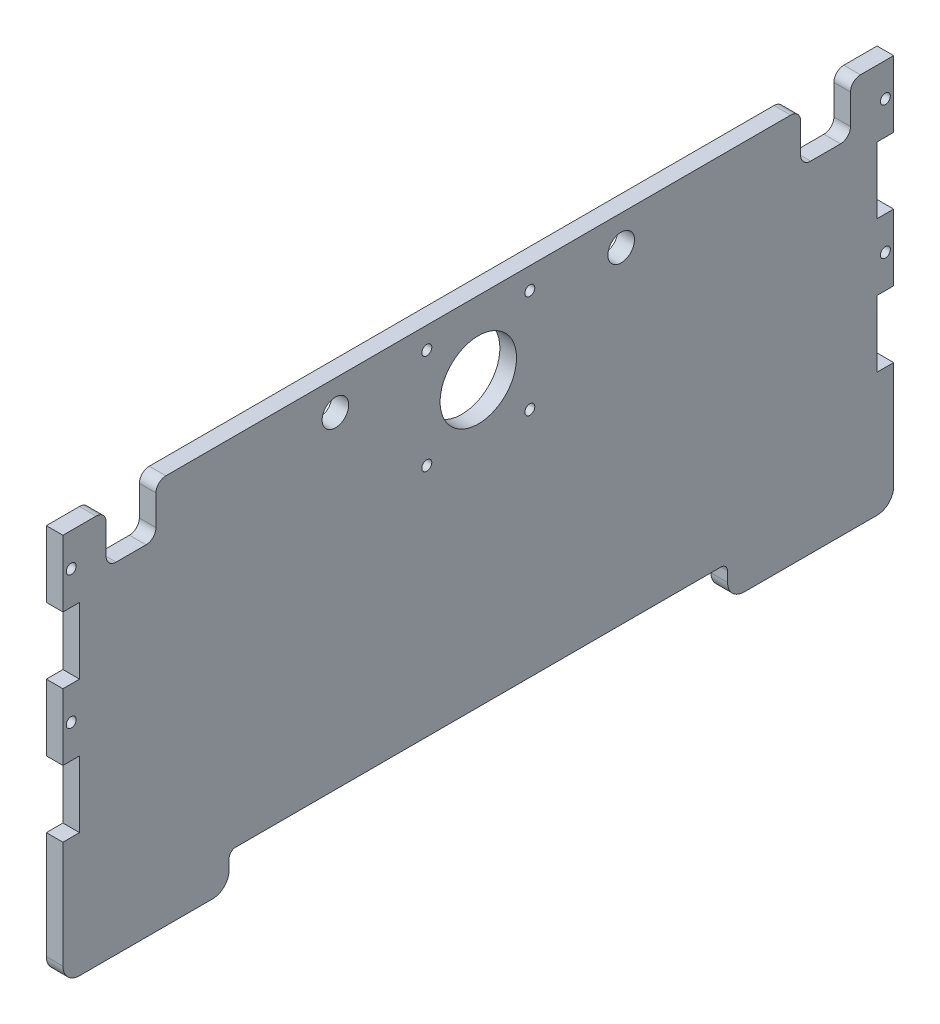
from build123d import *

# Parameters (mm, degrees)
SKETCH_1_R      = 4
SKETCH_1_R_2    = 11.5
SKETCH_1_R_3    = 1.5
EXTRUDE_1_DEPTH = 5


with BuildPart() as part:
    # 草图1 → 凸台-拉伸1 (new body)
    with BuildSketch(Plane(origin=(0, 0, 0), x_dir=(0, 0, -1), z_dir=(1, 0, 0))):
        with BuildLine():
            Line((-69.746431282, -6.912239682), (-69.746431282, -3.912239682))
            ThreePointArc((-69.746431282, -3.912239682), (-69.160644844, -2.49802612), (-67.746431282, -1.912239682))
            Line((-67.746431282, -1.912239682), (78.253568718, -1.912239682))
            ThreePointArc((78.253568718, -1.912239682), (79.667782281, -2.49802612), (80.253568718, -3.912239682))
            Line((80.253568718, -3.912239682), (80.253568718, -6.912239682))
            ThreePointArc((80.253568718, -6.912239682), (81.718034813, -10.447773588), (85.253568718, -11.912239682))
            Line((85.253568718, -11.912239682), (125.253568718, -11.912239682))
            ThreePointArc((125.253568718, -11.912239682), (128.789102624, -10.447773588), (130.253568718, -6.912239682))
            Line((130.253568718, -6.912239682), (130.253568718, 25.387760318))
            Line((130.253568718, 25.387760318), (125.253568718, 25.387760318))
            Line((125.253568718, 25.387760318), (125.253568718, 45.387760318))
            Line((125.253568718, 45.387760318), (130.253568718, 45.387760318))
            Line((130.253568718, 45.387760318), (130.253568718, 65.387760318))
            Line((130.253568718, 65.387760318), (125.253568718, 65.387760318))
            Line((125.253568718, 65.387760318), (125.253568718, 85.387760318))
            Line((125.253568718, 85.387760318), (130.253568718, 85.387760318))
            Line((130.253568718, 85.387760318), (130.253568718, 105.387760318))
            Line((130.253568718, 105.387760318), (120.253568718, 105.387760318))
            ThreePointArc((120.253568718, 105.387760318), (118.132248375, 104.509080662), (117.253568718, 102.387760318))
            Line((117.253568718, 102.387760318), (117.253568718, 93.387760318))
            ThreePointArc((117.253568718, 93.387760318), (116.374889062, 91.266439974), (114.253568718, 90.387760318))
            Line((114.253568718, 90.387760318), (105.253568718, 90.387760318))
            ThreePointArc((105.253568718, 90.387760318), (103.132248375, 91.266439974), (102.253568718, 93.387760318))
            Line((102.253568718, 93.387760318), (102.253568718, 102.387760318))
            ThreePointArc((102.253568718, 102.387760318), (101.374889062, 104.509080662), (99.253568718, 105.387760318))
            Line((99.253568718, 105.387760318), (-88.746431282, 105.387760318))
            ThreePointArc((-88.746431282, 105.387760318), (-90.867751625, 104.509080662), (-91.746431282, 102.387760318))
            Line((-91.746431282, 102.387760318), (-91.746431282, 93.387760318))
            ThreePointArc((-91.746431282, 93.387760318), (-92.625110938, 91.266439974), (-94.746431282, 90.387760318))
            Line((-94.746431282, 90.387760318), (-103.746431282, 90.387760318))
            ThreePointArc((-103.746431282, 90.387760318), (-105.867751625, 91.266439974), (-106.746431282, 93.387760318))
            Line((-106.746431282, 93.387760318), (-106.746431282, 102.387760318))
            ThreePointArc((-106.746431282, 102.387760318), (-107.625110938, 104.509080662), (-109.746431282, 105.387760318))
            Line((-109.746431282, 105.387760318), (-119.746431282, 105.387760318))
            Line((-119.746431282, 105.387760318), (-119.746431282, 85.387760318))
            Line((-119.746431282, 85.387760318), (-114.746431282, 85.387760318))
            Line((-114.746431282, 85.387760318), (-114.746431282, 65.387760318))
            Line((-114.746431282, 65.387760318), (-119.746431282, 65.387760318))
            Line((-119.746431282, 65.387760318), (-119.746431282, 45.387760318))
            Line((-119.746431282, 45.387760318), (-114.746431282, 45.387760318))
            Line((-114.746431282, 45.387760318), (-114.746431282, 25.387760318))
            Line((-114.746431282, 25.387760318), (-119.746431282, 25.387760318))
            Line((-119.746431282, 25.387760318), (-119.746431282, -6.912239682))
            ThreePointArc((-119.746431282, -6.912239682), (-118.281965187, -10.447773588), (-114.746431282, -11.912239682))
            Line((-114.746431282, -11.912239682), (-74.746431282, -11.912239682))
            ThreePointArc((-74.746431282, -11.912239682), (-71.210897376, -10.447773588), (-69.746431282, -6.912239682))
        make_face()
        with Locations((48.253568718, 96.387760318)):
            Circle(SKETCH_1_R, mode=Mode.SUBTRACT)
        with Locations((-37.746431282, 96.387760318)):
            Circle(SKETCH_1_R, mode=Mode.SUBTRACT)
        with Locations((5.253568718, 83.387760318)):
            Circle(SKETCH_1_R_2, mode=Mode.SUBTRACT)
        with Locations((-10.246431282, 98.887760318)):
            Circle(SKETCH_1_R_3, mode=Mode.SUBTRACT)
        with Locations((20.753568718, 98.887760318)):
            Circle(SKETCH_1_R_3, mode=Mode.SUBTRACT)
        with Locations((20.753568718, 67.887760318)):
            Circle(SKETCH_1_R_3, mode=Mode.SUBTRACT)
        with Locations((-10.246431282, 68.825049391)):
            Circle(SKETCH_1_R_3, mode=Mode.SUBTRACT)
        with Locations((127.753568718, 95.387760318)):
            Circle(SKETCH_1_R_3, mode=Mode.SUBTRACT)
        with Locations((127.753568718, 55.387760318)):
            Circle(SKETCH_1_R_3, mode=Mode.SUBTRACT)
        with Locations((-117.246431282, 95.387760318)):
            Circle(SKETCH_1_R_3, mode=Mode.SUBTRACT)
        with Locations((-117.246431282, 55.387760318)):
            Circle(SKETCH_1_R_3, mode=Mode.SUBTRACT)
    extrude(amount=EXTRUDE_1_DEPTH)


solid = part.part
